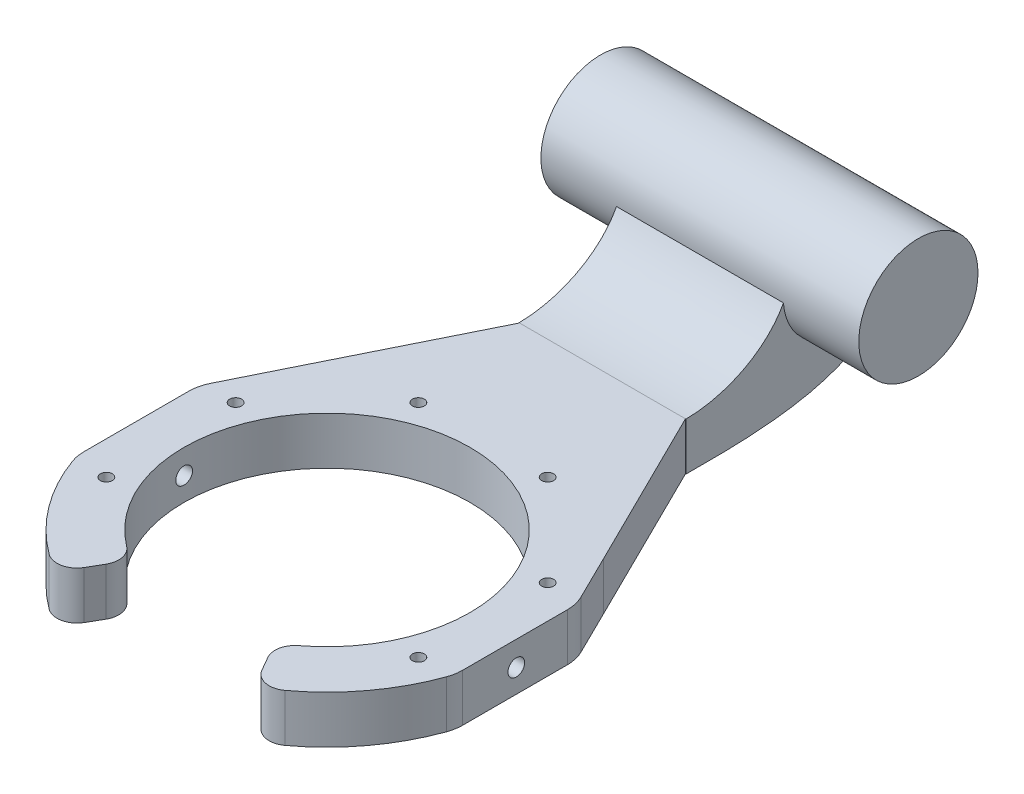
from build123d import *

# Parameters (mm, degrees)
BOSS_EXTRUDE1_DEPTH = 12
SKETCH2_R           = 18
CUT_EXTRUDE1_DEPTH  = 12
BOSS_EXTRUDE2_DEPTH = 21
SKETCH8_R           = 15
BOSS_EXTRUDE4_DEPTH = 40
SKETCH12_R          = 1.5
CUT_EXTRUDE3_DEPTH  = 136.830697271
SKETCH13_R          = 36
CUT_EXTRUDE4_DEPTH  = 136.830697271
CUT_EXTRUDE5_DEPTH  = 136.830697271
FILLET1_R           = 5
M5_TAPPED_HOLE1_D   = 4.2
CUT_EXTRUDE6_DEPTH  = 136.830697306
FILLET2_R           = 10


with BuildPart() as part:
    # Sketch1 → Boss-Extrude1 (new body)
    with BuildSketch(Plane(origin=(0, 0, 0), x_dir=(1, 0, 0), z_dir=(0, 1, 0))):
        with BuildLine():
            Line((-20.882573235, 69.325415808), (20.882573235, 69.325415808))
            Line((20.882573235, 69.325415808), (41.057018878, 28.536313722))
            ThreePointArc((41.057018878, 28.536313722), (44.846867978, 22.107881683), (47.637749602, 15.186994859))
            Line((47.637749602, 15.186994859), (47.637749602, -15.186994859))
            ThreePointArc((47.637749602, -15.186994859), (0, -50), (-47.637749602, -15.186994859))
            Line((-47.637749602, -15.186994859), (-47.637749602, 15.186994859))
            ThreePointArc((-47.637749602, 15.186994859), (-44.846867978, 22.107881683), (-41.057018878, 28.536313722))
            Line((-41.057018878, 28.536313722), (-20.882573235, 69.325415808))
        make_face()
    extrude(amount=BOSS_EXTRUDE1_DEPTH)

    # Sketch2 → Cut-Extrude1 (cut)
    with BuildSketch(Plane.XZ):
        with Locations(Location((0, 0, 0), (0, 0, 270))):
            Circle(SKETCH2_R)
    extrude(amount=-CUT_EXTRUDE1_DEPTH, mode=Mode.SUBTRACT)

    # Sketch4 → Boss-Extrude2 (add, symmetric)
    with BuildSketch(Plane(origin=(0, 0, 0), x_dir=(0, 0, -1), z_dir=(1, 0, 0))):
        with BuildLine():
            add(Edge.make_bspline(
                [(69.325415808, 12), (78.050182199, 12), (89.075370915, 16.109716253), (93.862821874, 25.051459816)],
                knots=[0, 0, 0, 0, 0.77117819, 0.77117819, 0.77117819, 0.77117819], degree=3))
            Line((69.325415808, 12), (69.325415808, 0))
            add(Edge.make_bspline(
                [(69.325415808, 0), (85.617905629, 0), (116.367065239, -0.702532384), (121.3953127, 17.938299278)],
                knots=[0, 0, 0, 0, 1, 1, 1, 1], degree=3))
            ThreePointArc((121.3953127, 17.938299278), (105.072430052, 11.59905464), (93.862821874, 25.051459816))
        make_face()
    extrude(amount=BOSS_EXTRUDE2_DEPTH, both=True)

    # Sketch8 → Boss-Extrude4 (add, symmetric)
    with BuildSketch(Plane(origin=(0, 0, 0), x_dir=(0, 0, -1), z_dir=(1, 0, 0))):
        with Locations((108.824557436, 26.122192734)):
            Circle(SKETCH8_R)
    extrude(amount=BOSS_EXTRUDE4_DEPTH, both=True)

    # Sketch12 → Cut-Extrude3 (cut, through all)
    with BuildSketch(Plane(origin=(0, 12, 0), x_dir=(1, 0, 0), z_dir=(0, 1, 0))):
        with Locations(Location((-16.264045876, 39.264880132, 0), (0, 0, 270))):
            Circle(SKETCH12_R)
        with Locations(Location((16.264045876, 39.264880132, 0), (0, 0, 270))):
            Circle(SKETCH12_R)
        with Locations(Location((39.264880132, 16.264045876, 0), (0, 0, 270))):
            Circle(SKETCH12_R)
        with Locations(Location((39.264880132, -16.264045876, 0), (0, 0, 270))):
            Circle(SKETCH12_R)
        with Locations(Location((-39.264880132, -16.264045876, 0), (0, 0, 270))):
            Circle(SKETCH12_R)
        with Locations(Location((-39.264880132, 16.264045876, 0), (0, 0, 270))):
            Circle(SKETCH12_R)
    extrude(amount=-CUT_EXTRUDE3_DEPTH, mode=Mode.SUBTRACT)

    # Sketch13 → Cut-Extrude4 (cut, through all)
    with BuildSketch(Plane(origin=(0, 12, 0), x_dir=(1, 0, 0), z_dir=(0, 1, 0))):
        with Locations(Location((0, 0, 0), (0, 0, 270))):
            Circle(SKETCH13_R)
    extrude(amount=-CUT_EXTRUDE4_DEPTH, mode=Mode.SUBTRACT)

    # Sketch14 → Cut-Extrude5 (cut, through all)
    with BuildSketch(Plane(origin=(0, 12, 0), x_dir=(1, 0, 0), z_dir=(0, 1, 0))):
        with BuildLine():
            Line((0, 0), (-48.782083041, -84.493046326))
            ThreePointArc((-48.782083041, -84.493046326), (0, -97.564166081), (48.782083041, -84.493046326))
            Line((48.782083041, -84.493046326), (0, 0))
        make_face()
    extrude(amount=-CUT_EXTRUDE5_DEPTH, mode=Mode.SUBTRACT)

    # Fillet1
    fillet1_edges = [part.edges().sort_by_distance(p)[0] for p in [
        (-18, 6, 31.176914536),
        (18, 6, 31.176914536),
        (25, 6, 43.301270189),
        (-25, 6, 43.301270189),
    ]]
    fillet(fillet1_edges, radius=FILLET1_R)

    # M5 Tapped Hole1 (through all)
    with Locations(Plane(origin=(-47.637749602, 5.86539704, 5.141e-06), x_dir=(0, 0, -1), z_dir=(-1, 0, 0))):
        with Locations((0, 0)):
            Hole(M5_TAPPED_HOLE1_D / 2)

    # Sketch30 → Cut-Extrude6 (cut, through all)
    with BuildSketch(Plane(origin=(0, 12, 0), x_dir=(1, 0, 0), z_dir=(0, 1, 0))):
        Polygon((-41.057018878, 28.536313722), (-47.637749602, 15.186994859), (-55.094112821, 25.321901869), align=None)
        Polygon((41.057018878, 28.536313722), (47.637749602, 15.186994859), (61.944517535, 29.154568453), align=None)
    extrude(amount=-CUT_EXTRUDE6_DEPTH, mode=Mode.SUBTRACT)

    # Fillet2
    fillet2_edges = [part.edges().sort_by_distance(p)[0] for p in [
        (-41.057018878, 6, -28.536313722),
        (41.057018878, 6, -28.536313722),
        (47.637749602, 6, -15.186994859),
        (47.637749602, 6, 15.186994859),
        (-47.637749602, 6, 15.186994859),
        (-47.637749602, 6, -15.186994859),
    ]]
    fillet(fillet2_edges, radius=FILLET2_R)


solid = part.part
